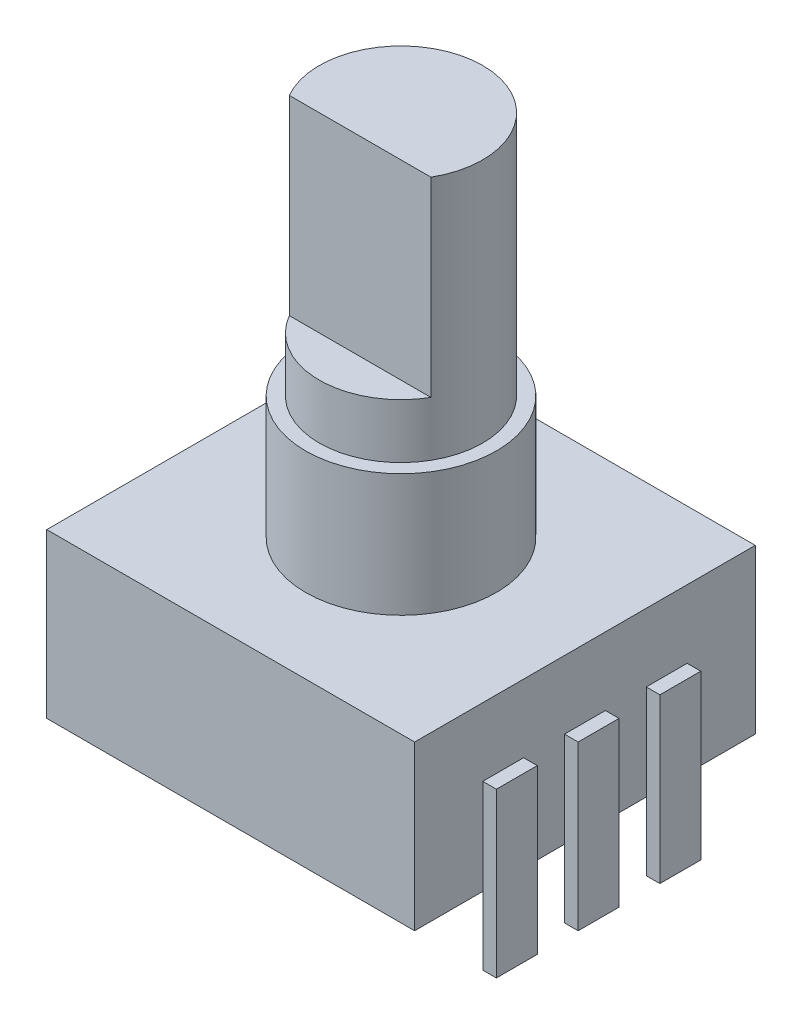
from build123d import *

# Parameters (mm, degrees)
EXTRUDE_1_DEPTH = 13.5
EXTRUDE_2_DEPTH = 6.5
SKETCH_1_4_R    = 3.5
EXTRUDE_3_DEPTH = 4.5
SKETCH_1_5_W    = 13.5
SKETCH_1_5_H    = 12.5
SKETCH_1_5_R    = 3.5
EXTRUDE_4_DEPTH = 6
EXTRUDE_START   = -2.5
SKETCH_2_W      = 0.5
SKETCH_2_H      = 1.5
EXTRUDE_5_DEPTH = 6


with BuildPart() as part:
    # Эскиз1 → Бобышка-Вытянуть1 (new body)
    with BuildSketch(Plane(origin=(0, 0, 0), x_dir=(1, 0, 0), z_dir=(0, 1, 0))):
        with BuildLine():
            ThreePointArc((3, 0), (-0.776457135, 2.897777479), (-2.598076211, -1.5))
            Line((-2.598076211, -1.5), (2.598076211, -1.5))
            ThreePointArc((2.598076211, -1.5), (2.897777479, -0.776457135), (3, 0))
        make_face()
    extrude(amount=EXTRUDE_1_DEPTH)

    # Эскиз1<3> → Бобышка-Вытянуть2 (add)
    with BuildSketch(Plane(origin=(0, 0, 0), x_dir=(1, 0, 0), z_dir=(0, 1, 0))):
        with BuildLine():
            Line((2.598076211, -1.5), (-2.598076211, -1.5))
            ThreePointArc((-2.598076211, -1.5), (0, -3), (2.598076211, -1.5))
        make_face()
    extrude(amount=EXTRUDE_2_DEPTH)

    # Эскиз1<4> → Бобышка-Вытянуть3 (add)
    with BuildSketch(Plane(origin=(0, 0, 0), x_dir=(1, 0, 0), z_dir=(0, 1, 0))):
        Circle(SKETCH_1_4_R)
    extrude(amount=EXTRUDE_3_DEPTH)


with BuildPart() as body_2:
    # Эскиз1<5> → Бобышка-Вытянуть4 (new body)
    with BuildSketch(Plane(origin=(0, 0, 0), x_dir=(1, 0, 0), z_dir=(0, 1, 0))):
        Rectangle(SKETCH_1_5_W, SKETCH_1_5_H)
        Circle(SKETCH_1_5_R, mode=Mode.SUBTRACT)
    extrude(amount=-EXTRUDE_4_DEPTH)

    # Эскиз2 → Бобышка-Вытянуть5 (add)
    with BuildSketch(Plane(origin=(0, 0, 0), x_dir=(1, 0, 0), z_dir=(0, 1, 0)).offset(EXTRUDE_START)):
        with Locations((7, 3)):
            Rectangle(SKETCH_2_W, SKETCH_2_H)
        with Locations((7, 0)):
            Rectangle(SKETCH_2_W, SKETCH_2_H)
        with Locations((7, -3)):
            Rectangle(SKETCH_2_W, SKETCH_2_H)
        with Locations((-7, 2.75)):
            Rectangle(SKETCH_2_W, SKETCH_2_H)
        with Locations((-7, -2.75)):
            Rectangle(SKETCH_2_W, SKETCH_2_H)
    extrude(amount=-EXTRUDE_5_DEPTH)


solid = Compound([part.part, body_2.part])
